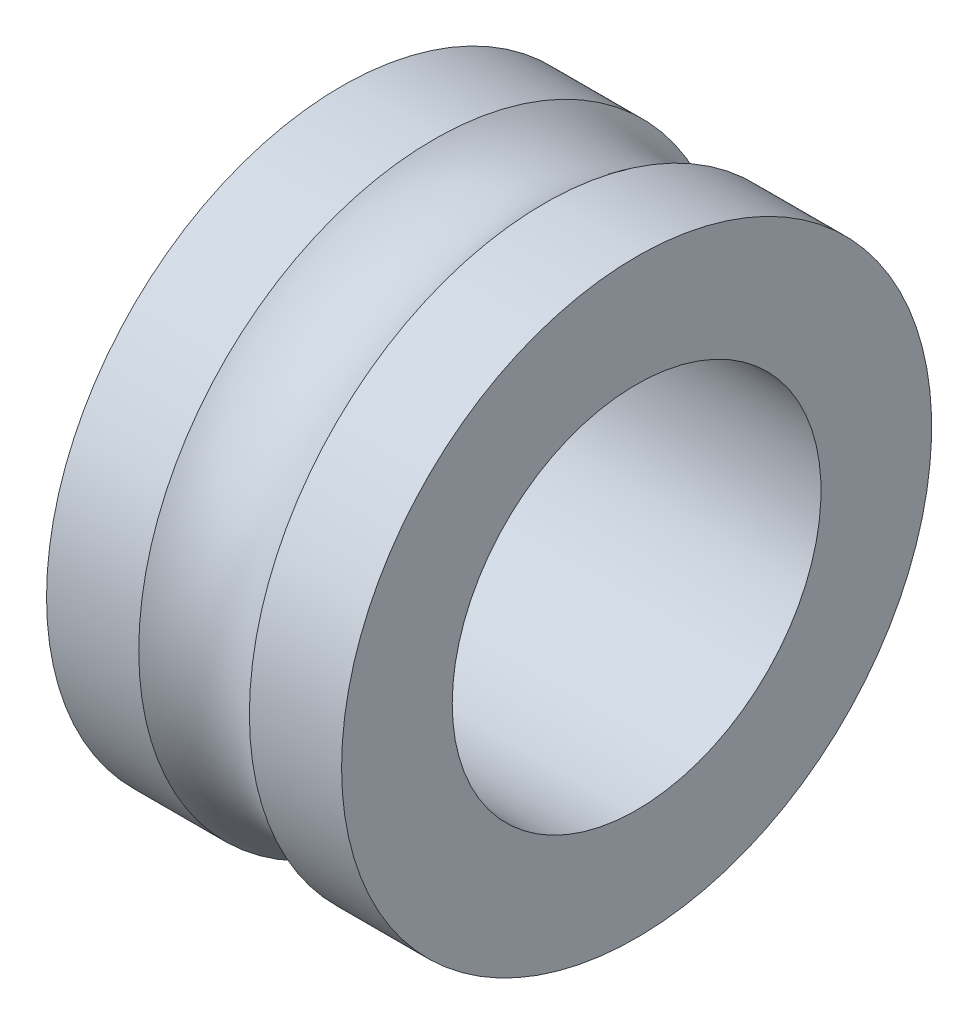
from build123d import *


with BuildPart() as part:
    # Esquisse1 → Révolution1 (revolve)
    with BuildSketch(Plane.XY, mode=Mode.PRIVATE) as r_volution1_sk:
        with BuildLine():
            Line((-1.5, 2), (-4, 2))
            Line((-4, 2), (-4, 5))
            Line((-4, 5), (4, 5))
            Line((4, 5), (4, 2))
            Line((4, 2), (1.5, 2))
            ThreePointArc((1.5, 2), (0, 2.5), (-1.5, 2))
        make_face()
    revolve(r_volution1_sk.sketch.rotate(Axis((-1003.745986035, 10, 0), (1, 0, 0)), 270), axis=Axis((-1003.745986035, 10, 0), (1, 0, 0)))


solid = part.part
